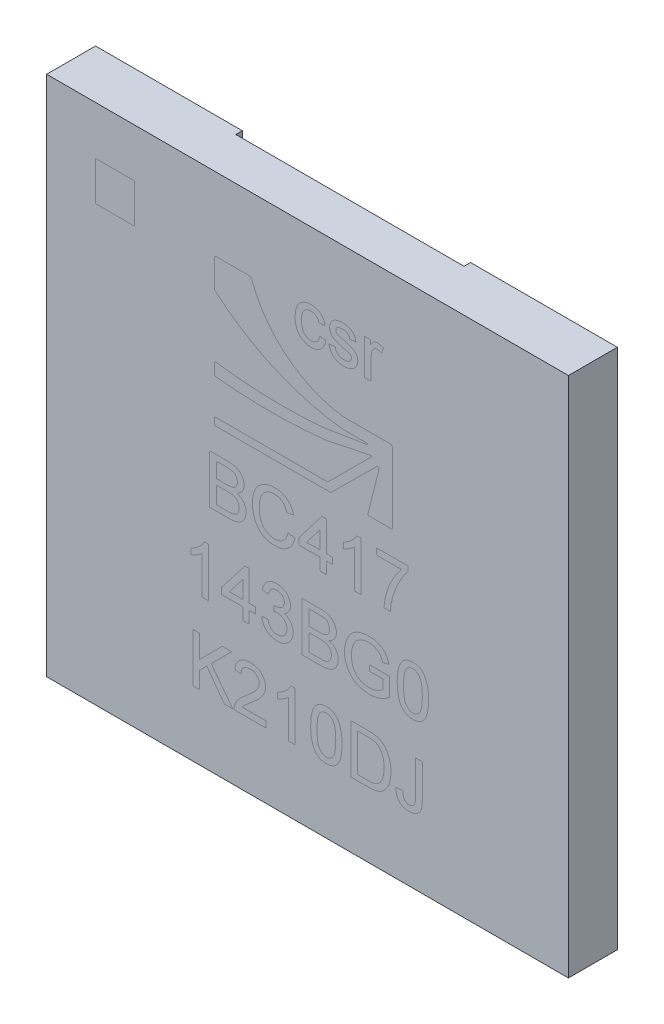
from build123d import *

# Parameters (mm, degrees)
SKETCH_1_W          = 8
SKETCH_1_H          = 8
EXTRUDE_1_DEPTH     = 0.75
SKETCH_2_R          = 0.154
EXTRUDE_2_DEPTH     = 0.1
SKETCH_3_W          = 3.5
SKETCH_3_H          = 6.43
CUT_EXTRUDE_2_DEPTH = 0.07
SKETCH_5_W          = 3.5
SKETCH_5_H          = 0.785
SKETCH_5_W_2        = 3.46960759
CUT_EXTRUDE_3_DEPTH = 0.1


with BuildPart() as part:
    # Эскиз1 → Бобышка-Вытянуть1 (new body)
    with BuildSketch(Plane.XY):
        Rectangle(SKETCH_1_W, SKETCH_1_H)
    extrude(amount=EXTRUDE_1_DEPTH)

    # Эскиз2 → Бобышка-Вытянуть2 (add)
    with BuildSketch(Plane(origin=(0, 0, 0), x_dir=(-1, 0, 0), z_dir=(0, 0, -1))):
        with Locations((3.598587951, 3.68)):
            Circle(SKETCH_2_R)
        with Locations((3.598587951, 3.11)):
            Circle(SKETCH_2_R)
        with Locations((3.598587951, 2.54)):
            Circle(SKETCH_2_R)
        with Locations((3.598587951, 1.97)):
            Circle(SKETCH_2_R)
        with Locations((3.598587951, 1.4)):
            Circle(SKETCH_2_R)
        with Locations((3.598587951, 0.83)):
            Circle(SKETCH_2_R)
        with Locations((3.598587951, 0.26)):
            Circle(SKETCH_2_R)
        with Locations((3.148587951, 3.11)):
            Circle(SKETCH_2_R)
        with Locations((3.148587951, 2.54)):
            Circle(SKETCH_2_R)
        with Locations((3.148587951, 1.97)):
            Circle(SKETCH_2_R)
        with Locations((3.148587951, 1.4)):
            Circle(SKETCH_2_R)
        with Locations((3.148587951, 0.83)):
            Circle(SKETCH_2_R)
        with Locations((3.148587951, 0.26)):
            Circle(SKETCH_2_R)
        with Locations((2.698587951, 3.11)):
            Circle(SKETCH_2_R)
        with Locations((2.698587951, 2.54)):
            Circle(SKETCH_2_R)
        with Locations((2.698587951, 1.97)):
            Circle(SKETCH_2_R)
        with Locations((2.698587951, 1.4)):
            Circle(SKETCH_2_R)
        with Locations((2.698587951, 0.83)):
            Circle(SKETCH_2_R)
        with Locations((2.698587951, 0.26)):
            Circle(SKETCH_2_R)
        with Locations((2.248587951, 3.11)):
            Circle(SKETCH_2_R)
        with Locations((2.248587951, 2.54)):
            Circle(SKETCH_2_R)
        with Locations((2.248587951, 1.97)):
            Circle(SKETCH_2_R)
        with Locations((2.248587951, 1.4)):
            Circle(SKETCH_2_R)
        with Locations((2.248587951, 0.83)):
            Circle(SKETCH_2_R)
        with Locations((2.248587951, 0.26)):
            Circle(SKETCH_2_R)
        with Locations((3.148587951, 3.68)):
            Circle(SKETCH_2_R)
        with Locations((2.698587951, 3.68)):
            Circle(SKETCH_2_R)
        with Locations((2.248587951, 3.68)):
            Circle(SKETCH_2_R)
        with Locations(Location((2.248587951, -3.68, 0), (0, 0, 180))):
            Circle(SKETCH_2_R)
        with Locations(Location((2.698587951, -3.68, 0), (0, 0, 180))):
            Circle(SKETCH_2_R)
        with Locations(Location((3.148587951, -3.68, 0), (0, 0, 180))):
            Circle(SKETCH_2_R)
        with Locations(Location((2.248587951, -0.26, 0), (0, 0, 180))):
            Circle(SKETCH_2_R)
        with Locations(Location((2.248587951, -0.83, 0), (0, 0, 180))):
            Circle(SKETCH_2_R)
        with Locations(Location((2.248587951, -1.4, 0), (0, 0, 180))):
            Circle(SKETCH_2_R)
        with Locations(Location((2.248587951, -1.97, 0), (0, 0, 180))):
            Circle(SKETCH_2_R)
        with Locations(Location((2.248587951, -2.54, 0), (0, 0, 180))):
            Circle(SKETCH_2_R)
        with Locations(Location((2.248587951, -3.11, 0), (0, 0, 180))):
            Circle(SKETCH_2_R)
        with Locations(Location((2.698587951, -0.26, 0), (0, 0, 180))):
            Circle(SKETCH_2_R)
        with Locations(Location((2.698587951, -0.83, 0), (0, 0, 180))):
            Circle(SKETCH_2_R)
        with Locations(Location((2.698587951, -1.4, 0), (0, 0, 180))):
            Circle(SKETCH_2_R)
        with Locations(Location((2.698587951, -1.97, 0), (0, 0, 180))):
            Circle(SKETCH_2_R)
        with Locations(Location((2.698587951, -2.54, 0), (0, 0, 180))):
            Circle(SKETCH_2_R)
        with Locations(Location((2.698587951, -3.11, 0), (0, 0, 180))):
            Circle(SKETCH_2_R)
        with Locations(Location((3.148587951, -0.26, 0), (0, 0, 180))):
            Circle(SKETCH_2_R)
        with Locations(Location((3.148587951, -0.83, 0), (0, 0, 180))):
            Circle(SKETCH_2_R)
        with Locations(Location((3.148587951, -1.4, 0), (0, 0, 180))):
            Circle(SKETCH_2_R)
        with Locations(Location((3.148587951, -1.97, 0), (0, 0, 180))):
            Circle(SKETCH_2_R)
        with Locations(Location((3.148587951, -2.54, 0), (0, 0, 180))):
            Circle(SKETCH_2_R)
        with Locations(Location((3.148587951, -3.11, 0), (0, 0, 180))):
            Circle(SKETCH_2_R)
        with Locations(Location((3.598587951, -0.26, 0), (0, 0, 180))):
            Circle(SKETCH_2_R)
        with Locations(Location((3.598587951, -0.83, 0), (0, 0, 180))):
            Circle(SKETCH_2_R)
        with Locations(Location((3.598587951, -1.4, 0), (0, 0, 180))):
            Circle(SKETCH_2_R)
        with Locations(Location((3.598587951, -1.97, 0), (0, 0, 180))):
            Circle(SKETCH_2_R)
        with Locations(Location((3.598587951, -2.54, 0), (0, 0, 180))):
            Circle(SKETCH_2_R)
        with Locations(Location((3.598587951, -3.11, 0), (0, 0, 180))):
            Circle(SKETCH_2_R)
        with Locations((-3.598587951, -3.11)):
            Circle(SKETCH_2_R)
        with Locations((-3.598587951, -2.54)):
            Circle(SKETCH_2_R)
        with Locations((-3.598587951, -1.97)):
            Circle(SKETCH_2_R)
        with Locations((-3.598587951, -1.4)):
            Circle(SKETCH_2_R)
        with Locations((-3.598587951, -0.83)):
            Circle(SKETCH_2_R)
        with Locations((-3.598587951, -0.26)):
            Circle(SKETCH_2_R)
        with Locations((-3.148587951, -3.11)):
            Circle(SKETCH_2_R)
        with Locations((-3.148587951, -2.54)):
            Circle(SKETCH_2_R)
        with Locations((-3.148587951, -1.97)):
            Circle(SKETCH_2_R)
        with Locations((-3.148587951, -1.4)):
            Circle(SKETCH_2_R)
        with Locations((-3.148587951, -0.83)):
            Circle(SKETCH_2_R)
        with Locations((-3.148587951, -0.26)):
            Circle(SKETCH_2_R)
        with Locations((-2.698587951, -3.11)):
            Circle(SKETCH_2_R)
        with Locations((-2.698587951, -2.54)):
            Circle(SKETCH_2_R)
        with Locations((-2.698587951, -1.97)):
            Circle(SKETCH_2_R)
        with Locations((-2.698587951, -1.4)):
            Circle(SKETCH_2_R)
        with Locations((-2.698587951, -0.83)):
            Circle(SKETCH_2_R)
        with Locations((-2.698587951, -0.26)):
            Circle(SKETCH_2_R)
        with Locations((-2.248587951, -3.11)):
            Circle(SKETCH_2_R)
        with Locations((-2.248587951, -2.54)):
            Circle(SKETCH_2_R)
        with Locations((-2.248587951, -1.97)):
            Circle(SKETCH_2_R)
        with Locations((-2.248587951, -1.4)):
            Circle(SKETCH_2_R)
        with Locations((-2.248587951, -0.83)):
            Circle(SKETCH_2_R)
        with Locations((-2.248587951, -0.26)):
            Circle(SKETCH_2_R)
        with Locations((-3.148587951, -3.68)):
            Circle(SKETCH_2_R)
        with Locations((-2.698587951, -3.68)):
            Circle(SKETCH_2_R)
        with Locations((-2.248587951, -3.68)):
            Circle(SKETCH_2_R)
        with Locations(Location((-2.248587951, 3.68, 0), (0, 0, 180))):
            Circle(SKETCH_2_R)
        with Locations(Location((-2.698587951, 3.68, 0), (0, 0, 180))):
            Circle(SKETCH_2_R)
        with Locations(Location((-3.148587951, 3.68, 0), (0, 0, 180))):
            Circle(SKETCH_2_R)
        with Locations(Location((-2.248587951, 0.26, 0), (0, 0, 180))):
            Circle(SKETCH_2_R)
        with Locations(Location((-2.248587951, 0.83, 0), (0, 0, 180))):
            Circle(SKETCH_2_R)
        with Locations(Location((-2.248587951, 1.4, 0), (0, 0, 180))):
            Circle(SKETCH_2_R)
        with Locations(Location((-2.248587951, 1.97, 0), (0, 0, 180))):
            Circle(SKETCH_2_R)
        with Locations(Location((-2.248587951, 2.54, 0), (0, 0, 180))):
            Circle(SKETCH_2_R)
        with Locations(Location((-2.248587951, 3.11, 0), (0, 0, 180))):
            Circle(SKETCH_2_R)
        with Locations(Location((-2.698587951, 0.26, 0), (0, 0, 180))):
            Circle(SKETCH_2_R)
        with Locations(Location((-2.698587951, 0.83, 0), (0, 0, 180))):
            Circle(SKETCH_2_R)
        with Locations(Location((-2.698587951, 1.4, 0), (0, 0, 180))):
            Circle(SKETCH_2_R)
        with Locations(Location((-2.698587951, 1.97, 0), (0, 0, 180))):
            Circle(SKETCH_2_R)
        with Locations(Location((-2.698587951, 2.54, 0), (0, 0, 180))):
            Circle(SKETCH_2_R)
        with Locations(Location((-2.698587951, 3.11, 0), (0, 0, 180))):
            Circle(SKETCH_2_R)
        with Locations(Location((-3.148587951, 0.26, 0), (0, 0, 180))):
            Circle(SKETCH_2_R)
        with Locations(Location((-3.148587951, 0.83, 0), (0, 0, 180))):
            Circle(SKETCH_2_R)
        with Locations(Location((-3.148587951, 1.4, 0), (0, 0, 180))):
            Circle(SKETCH_2_R)
        with Locations(Location((-3.148587951, 1.97, 0), (0, 0, 180))):
            Circle(SKETCH_2_R)
        with Locations(Location((-3.148587951, 2.54, 0), (0, 0, 180))):
            Circle(SKETCH_2_R)
        with Locations(Location((-3.148587951, 3.11, 0), (0, 0, 180))):
            Circle(SKETCH_2_R)
        with Locations(Location((-3.598587951, 0.26, 0), (0, 0, 180))):
            Circle(SKETCH_2_R)
        with Locations(Location((-3.598587951, 0.83, 0), (0, 0, 180))):
            Circle(SKETCH_2_R)
        with Locations(Location((-3.598587951, 1.4, 0), (0, 0, 180))):
            Circle(SKETCH_2_R)
        with Locations(Location((-3.598587951, 1.97, 0), (0, 0, 180))):
            Circle(SKETCH_2_R)
        with Locations(Location((-3.598587951, 2.54, 0), (0, 0, 180))):
            Circle(SKETCH_2_R)
        with Locations(Location((-3.598587951, 3.11, 0), (0, 0, 180))):
            Circle(SKETCH_2_R)
        with Locations(Location((-3.598587951, 3.68, 0), (0, 0, 180))):
            Circle(SKETCH_2_R)
        with Locations((-3.598587951, -3.705)):
            Circle(SKETCH_2_R)
    extrude(amount=EXTRUDE_2_DEPTH)

    # Эскиз3 → Вырез-Вытянуть2 (cut)
    with BuildSketch(Plane(origin=(0, 0, 0), x_dir=(-1, 0, 0), z_dir=(0, 0, -1))):
        Rectangle(SKETCH_3_W, SKETCH_3_H)
    extrude(amount=-CUT_EXTRUDE_2_DEPTH, mode=Mode.SUBTRACT)

    # Эскиз5 → Вырез-Вытянуть3 (cut)
    with BuildSketch(Plane(origin=(0, 0, 0), x_dir=(-1, 0, 0), z_dir=(0, 0, -1))):
        with Locations((0, 3.6075)):
            Rectangle(SKETCH_5_W, SKETCH_5_H)
        with Locations((-0.015196205, -3.6075)):
            Rectangle(SKETCH_5_W_2, SKETCH_5_H)
    extrude(amount=-CUT_EXTRUDE_3_DEPTH, mode=Mode.SUBTRACT)


solid = part.part
